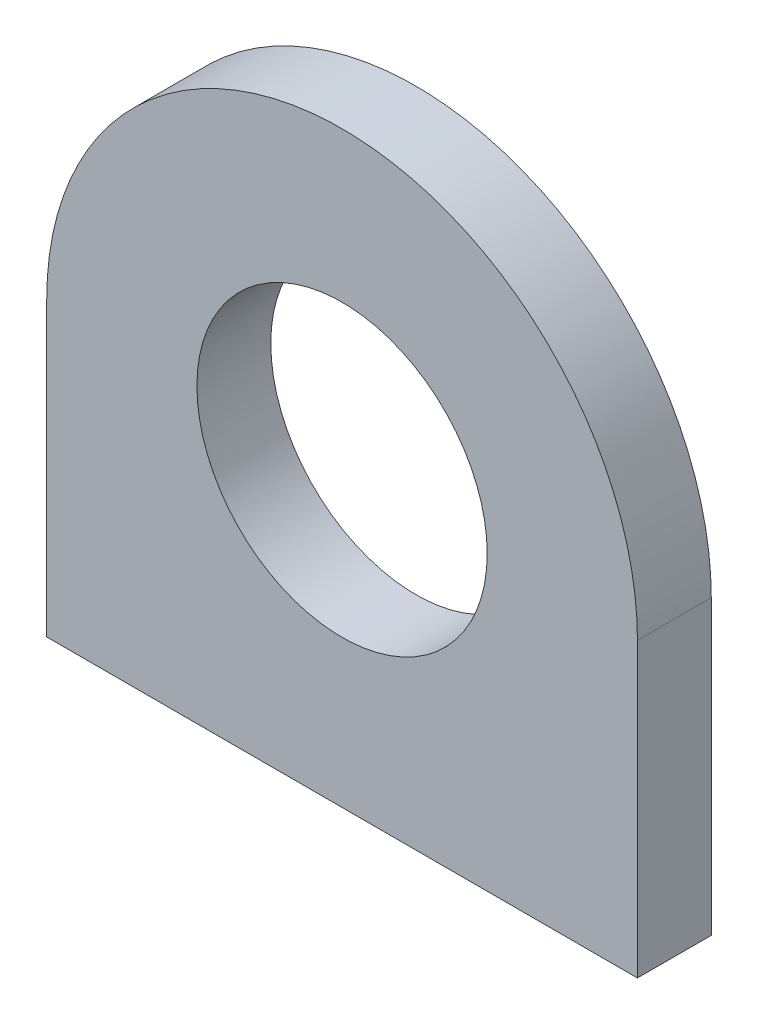
from build123d import *

# Parameters (mm, degrees)
SKETCH1_R           = 6.241069067
BOSS_EXTRUDE1_DEPTH = 3.175


with BuildPart() as part:
    # Sketch1 → Boss-Extrude1 (new body)
    with BuildSketch(Plane.XY):
        with BuildLine():
            Line((-12.7, 0), (-12.7, -12.575113464))
            Line((-12.7, -12.575113464), (12.7, -12.575113464))
            Line((12.7, -12.575113464), (12.7, 0))
            ThreePointArc((12.7, 0), (0, 12.7), (-12.7, 0))
        make_face()
        Circle(SKETCH1_R, mode=Mode.SUBTRACT)
    extrude(amount=BOSS_EXTRUDE1_DEPTH)


solid = part.part
